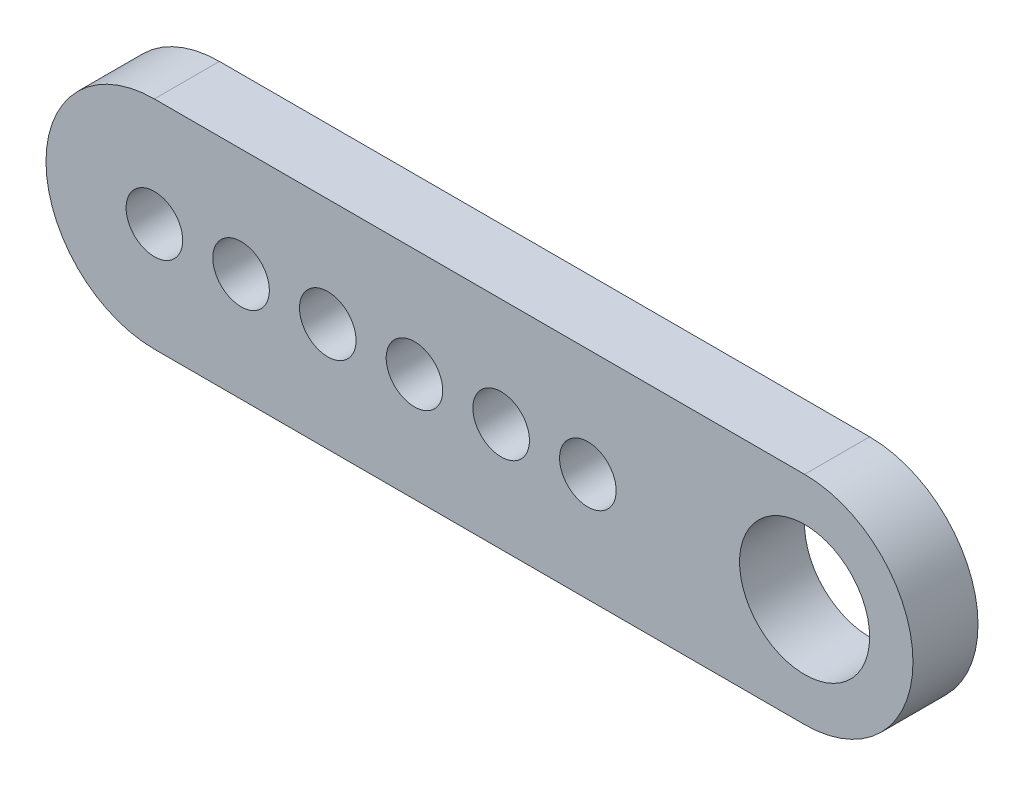
from build123d import *

# Parameters (mm, degrees)
ESQUISSE1_R        = 1.305103473
ESQUISSE1_R_2      = 3
BOSS_EXTRU_1_DEPTH = 3


with BuildPart() as part:
    # Esquisse1 → Boss.-Extru.1 (new body)
    with BuildSketch(Plane.XY):
        with BuildLine():
            Line((-30, -5), (0, -5))
            ThreePointArc((0, -5), (5, 0), (0, 5))
            Line((0, 5), (-30, 5))
            ThreePointArc((-30, 5), (-35, 0), (-30, -5))
        make_face()
        with Locations((-30, 0)):
            Circle(ESQUISSE1_R, mode=Mode.SUBTRACT)
        with Locations((-26, 0)):
            Circle(ESQUISSE1_R, mode=Mode.SUBTRACT)
        with Locations((-22, 0)):
            Circle(ESQUISSE1_R, mode=Mode.SUBTRACT)
        with Locations((-18, 0)):
            Circle(ESQUISSE1_R, mode=Mode.SUBTRACT)
        with Locations((-14, 0)):
            Circle(ESQUISSE1_R, mode=Mode.SUBTRACT)
        with Locations((-10, 0)):
            Circle(ESQUISSE1_R, mode=Mode.SUBTRACT)
        Circle(ESQUISSE1_R_2, mode=Mode.SUBTRACT)
    extrude(amount=BOSS_EXTRU_1_DEPTH)


solid = part.part
